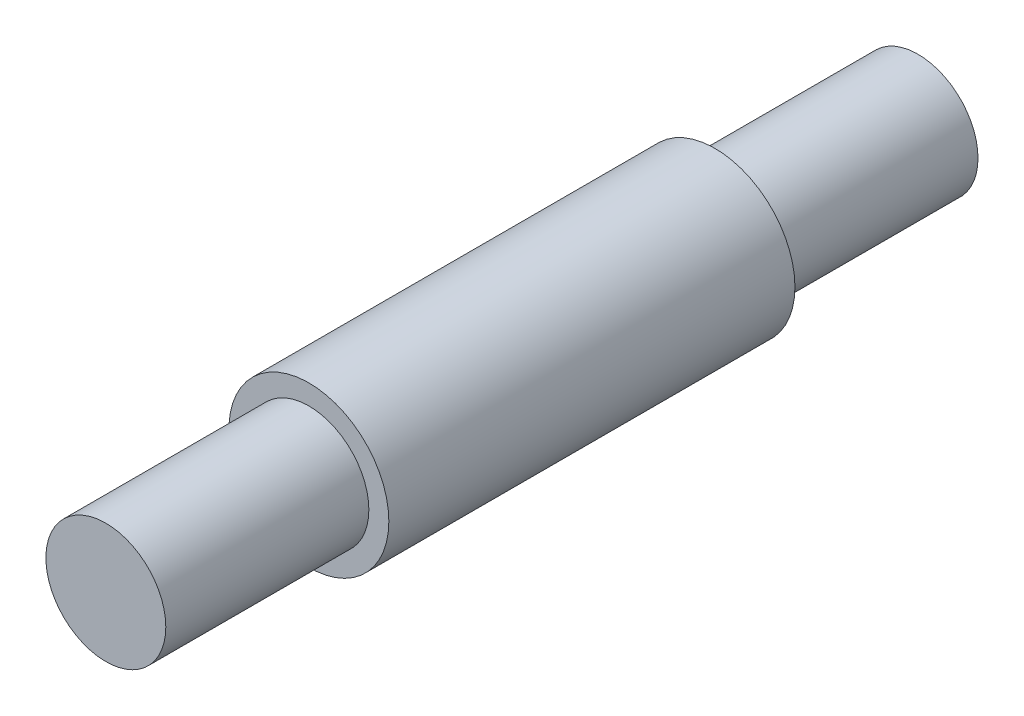
from build123d import *


with BuildPart() as part:
    # Sketch1 → Base-Revolve (revolve)
    with BuildSketch(Plane(origin=(0, 0, 0), x_dir=(0, 0, -1), z_dir=(1, 0, 0))):
        Polygon((-40, 0), (-40, 5.90625), (-20, 5.90625), (-20, 7.875), (20, 7.875), (20, 5.90625), (40, 5.90625), (40, 0), align=None)
    revolve(axis=Axis((0, 0, 61.5315), (0, 0, -1)))


solid = part.part
